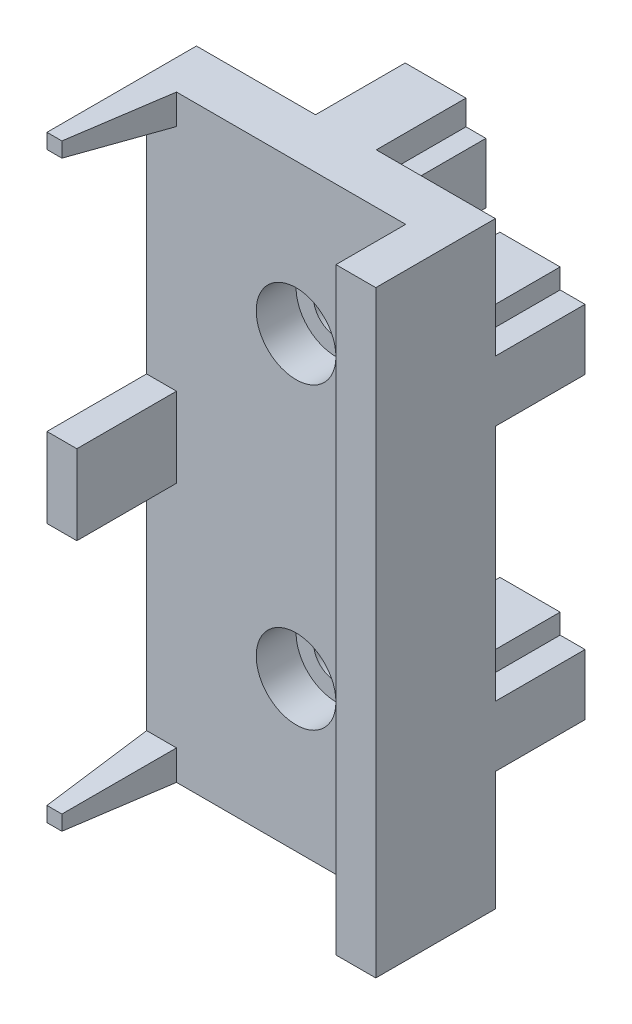
from build123d import *

# Parameters (mm, degrees)
SKETCH_1_W                   = 30
SKETCH_1_H                   = 60
EXTRUDE_1_DEPTH              = 5
SKETCH_2_W                   = 3
SKETCH_2_H                   = 3
SKETCH_2_W_2                 = 4
SKETCH_2_H_2                 = 60
SKETCH_2_H_3                 = 8
EXTRUDE_2_DEPTH              = 10
CUT_EXTRUDE_1_DEPTH          = 44.058100283
CUT_EXTRUDE_3_DEPTH          = 7
SKETCH_5_W                   = 4
SKETCH_5_H                   = 3
CUT_EXTRUDE_4_DEPTH          = 64.639610307
HOLE_WIZARD_M4_1_D           = 4.5
HOLE_WIZARD_M4_1_CBORE_D     = 8
HOLE_WIZARD_M4_1_CBORE_DEPTH = 4
EXTRUDE_3_DEPTH              = 10
CHAMFER_1_SIZE               = 1


with BuildPart() as part:
    # 스케치1 → 보스-돌출1 (new body)
    with BuildSketch(Plane.XY):
        Rectangle(SKETCH_1_W, SKETCH_1_H)
    extrude(amount=EXTRUDE_1_DEPTH)

    # 스케치2 → 보스-돌출2 (add)
    with BuildSketch(Plane.XY.offset(5)):
        with Locations((-13.5, -28.5)):
            Rectangle(SKETCH_2_W, SKETCH_2_H)
        with Locations((-13.5, 28.5)):
            Rectangle(SKETCH_2_W, SKETCH_2_H)
        with Locations((13, 0)):
            Rectangle(SKETCH_2_W_2, SKETCH_2_H_2)
        with Locations((-13.5, 0)):
            Rectangle(SKETCH_2_W, SKETCH_2_H_3)
    extrude(amount=EXTRUDE_2_DEPTH)

    # 스케치3 → 컷-돌출1 (cut, through all)
    with BuildSketch(Plane(origin=(-12, 0, 0), x_dir=(0, 0, -1), z_dir=(1, 0, 0))):
        Polygon((-15, -28.5), (-5, -27), (-15, -27), align=None)
    cut_extrude_1 = extrude(amount=-CUT_EXTRUDE_1_DEPTH, mode=Mode.SUBTRACT)

    # 스케치4 → 컷-돌출3 (cut)
    with BuildSketch(Plane.XZ.offset(30)):
        Polygon((-13.5, 15), (-12, 15), (-12, 5), align=None)
    cut_extrude_3 = extrude(amount=-CUT_EXTRUDE_3_DEPTH, mode=Mode.SUBTRACT)

    # 대칭 복사1: 컷-돌출1, 컷-돌출3 across plane
    add(cut_extrude_1.mirror(Plane(origin=(0, 0, 0), x_dir=(0, 0, 1), z_dir=(0, -1, 0))), mode=Mode.SUBTRACT)
    add(cut_extrude_3.mirror(Plane(origin=(0, 0, 0), x_dir=(0, 0, 1), z_dir=(0, -1, 0))), mode=Mode.SUBTRACT)

    # 스케치5 → 컷-돌출4 (cut, through all)
    with BuildSketch(Plane(origin=(0, 30, 0), x_dir=(1, 0, 0), z_dir=(0, 1, 0))):
        with Locations((13, -13.5)):
            Rectangle(SKETCH_5_W, SKETCH_5_H)
    extrude(amount=-CUT_EXTRUDE_4_DEPTH, mode=Mode.SUBTRACT)

    # M4 소켓 머리 캡 나사용 카운터보어1 (through all)
    with Locations(Plane.XY.offset(5)):
        with Locations((0, -15), (0, 15)):
            CounterBoreHole(HOLE_WIZARD_M4_1_D / 2, HOLE_WIZARD_M4_1_CBORE_D / 2, HOLE_WIZARD_M4_1_CBORE_DEPTH)

    # 스케치9 → 보스-돌출3 (add)
    with BuildSketch(Plane(origin=(0, 0, 0), x_dir=(-1, 0, 0), z_dir=(0, 0, -1))):
        with BuildLine():
            Line((-3.05, 30), (3.05, 30))
            Line((3.05, 30), (3.05, 27.5))
            Line((3.05, 27.5), (5.05, 27.5))
            Line((5.05, 27.5), (5.05, 21.454957169))
            ThreePointArc((5.05, 21.454957169), (0, 19.5), (-5.05, 21.454957169))
            Line((-5.05, 21.454957169), (-5.05, 27.5))
            Line((-5.05, 27.5), (-3.05, 27.5))
            Line((-3.05, 27.5), (-3.05, 30))
        make_face()
        with BuildLine():
            Line((15, 18.05), (15, 11.95))
            Line((15, 11.95), (12.5, 11.95))
            Line((12.5, 11.95), (12.5, 9.95))
            Line((12.5, 9.95), (6.454957169, 9.95))
            ThreePointArc((6.454957169, 9.95), (4.5, 15), (6.454957169, 20.05))
            Line((6.454957169, 20.05), (12.5, 20.05))
            Line((12.5, 20.05), (12.5, 18.05))
            Line((12.5, 18.05), (15, 18.05))
        make_face()
        with BuildLine():
            Line((-3.05, 2.5), (-5.05, 2.5))
            Line((-5.05, 2.5), (-5.05, 8.545042831))
            ThreePointArc((-5.05, 8.545042831), (0, 10.5), (5.05, 8.545042831))
            Line((5.05, 8.545042831), (5.05, 2.5))
            Line((5.05, 2.5), (3.05, 2.5))
            Line((3.05, 2.5), (3.05, -2.5))
            Line((3.05, -2.5), (5.05, -2.5))
            Line((5.05, -2.5), (5.05, -8.545042831))
            ThreePointArc((5.05, -8.545042831), (0, -10.5), (-5.05, -8.545042831))
            Line((-5.05, -8.545042831), (-5.05, -2.5))
            Line((-5.05, -2.5), (-3.05, -2.5))
            Line((-3.05, -2.5), (-3.05, 2.5))
        make_face()
        with BuildLine():
            Line((-15, 11.95), (-15, 18.05))
            Line((-15, 18.05), (-12.5, 18.05))
            Line((-12.5, 18.05), (-12.5, 20.05))
            Line((-12.5, 20.05), (-6.454957169, 20.05))
            ThreePointArc((-6.454957169, 20.05), (-4.5, 15), (-6.454957169, 9.95))
            Line((-6.454957169, 9.95), (-12.5, 9.95))
            Line((-12.5, 9.95), (-12.5, 11.95))
            Line((-12.5, 11.95), (-15, 11.95))
        make_face()
        with BuildLine():
            Line((-5.05, -27.5), (-5.05, -21.454957169))
            ThreePointArc((-5.05, -21.454957169), (0, -19.5), (5.05, -21.454957169))
            Line((5.05, -21.454957169), (5.05, -27.5))
            Line((5.05, -27.5), (3.05, -27.5))
            Line((3.05, -27.5), (3.05, -30))
            Line((3.05, -30), (-3.05, -30))
            Line((-3.05, -30), (-3.05, -27.5))
            Line((-3.05, -27.5), (-5.05, -27.5))
        make_face()
        with BuildLine():
            Line((-12.5, -9.95), (-6.454957169, -9.95))
            ThreePointArc((-6.454957169, -9.95), (-4.5, -15), (-6.454957169, -20.05))
            Line((-6.454957169, -20.05), (-12.5, -20.05))
            Line((-12.5, -20.05), (-12.5, -18.05))
            Line((-12.5, -18.05), (-15, -18.05))
            Line((-15, -18.05), (-15, -11.95))
            Line((-15, -11.95), (-12.5, -11.95))
            Line((-12.5, -11.95), (-12.5, -9.95))
        make_face()
        with BuildLine():
            Line((12.5, -20.05), (6.454957169, -20.05))
            ThreePointArc((6.454957169, -20.05), (4.5, -15), (6.454957169, -9.95))
            Line((6.454957169, -9.95), (12.5, -9.95))
            Line((12.5, -9.95), (12.5, -11.95))
            Line((12.5, -11.95), (15, -11.95))
            Line((15, -11.95), (15, -18.05))
            Line((15, -18.05), (12.5, -18.05))
            Line((12.5, -18.05), (12.5, -20.05))
        make_face()
    extrude(amount=EXTRUDE_3_DEPTH)

    # 모따기1
    chamfer_1_edges = [part.edges().sort_by_distance(p)[0] for p in [
        (3.05, 28.75, -10),
        (4.05, 27.5, -10),
        (5.05, 24.477478584, -10),
        (0, 19.5, -10),
        (-5.05, 24.477478584, -10),
        (-4.05, 27.5, -10),
        (-3.05, 28.75, -10),
        (0, 30, -10),
        (-13.75, 18.05, -10),
        (-12.5, 19.05, -10),
        (-9.477478584, 20.05, -10),
        (-4.5, 15, -10),
        (-9.477478584, 9.95, -10),
        (-12.5, 10.95, -10),
        (-13.75, 11.95, -10),
        (-15, 15, -10),
        (3.05, 0, -10),
        (4.05, -2.5, -10),
        (5.05, -5.522521416, -10),
        (0, -10.5, -10),
        (-5.05, -5.522521416, -10),
        (-4.05, -2.5, -10),
        (-3.05, 0, -10),
        (-4.05, 2.5, -10),
        (-5.05, 5.522521416, -10),
        (0, 10.5, -10),
        (5.05, 5.522521416, -10),
        (4.05, 2.5, -10),
        (13.75, 11.95, -10),
        (12.5, 10.95, -10),
        (9.477478584, 9.95, -10),
        (4.5, 15, -10),
        (9.477478584, 20.05, -10),
        (12.5, 19.05, -10),
        (13.75, 18.05, -10),
        (15, 15, -10),
        (0, -19.5, -10),
        (5.05, -24.477478584, -10),
        (4.05, -27.5, -10),
        (3.05, -28.75, -10),
        (0, -30, -10),
        (-3.05, -28.75, -10),
        (-4.05, -27.5, -10),
        (-5.05, -24.477478584, -10),
        (4.5, -15, -10),
        (9.477478584, -9.95, -10),
        (12.5, -10.95, -10),
        (13.75, -11.95, -10),
        (15, -15, -10),
        (13.75, -18.05, -10),
        (12.5, -19.05, -10),
        (9.477478584, -20.05, -10),
        (-4.5, -15, -10),
        (-9.477478584, -20.05, -10),
        (-12.5, -19.05, -10),
        (-13.75, -18.05, -10),
        (-15, -15, -10),
        (-13.75, -11.95, -10),
        (-12.5, -10.95, -10),
        (-9.477478584, -9.95, -10),
    ]]
    chamfer(chamfer_1_edges, length=CHAMFER_1_SIZE)


solid = part.part
